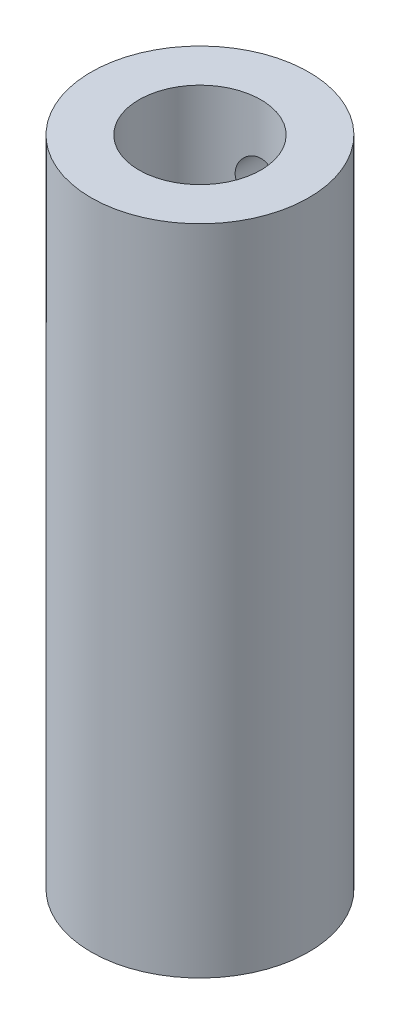
from build123d import *

# Parameters (mm, degrees)
IZIM1_R                     = 7.5
Y_KSEKLIK_EKSTR_ZYON1_DEPTH = 15
IZIM2_R                     = 7.5
IZIM2_R_2                   = 4.2
Y_KSEKLIK_EKSTR_ZYON2_DEPTH = 30
IZIM3_R                     = 1.5
KES_EKSTR_ZYON1_DEPTH       = 10


with BuildPart() as part:
    # Çizim1 → Yükseklik-Ekstrüzyon1 (new body)
    with BuildSketch(Plane(origin=(0, 0, 0), x_dir=(1, 0, 0), z_dir=(0, 1, 0))):
        with Locations(Location((0, 0, 0), (0, 0, 270))):
            Circle(IZIM1_R)
        with BuildLine():
            Line((-1.65, 2.2), (1.65, 2.2))
            ThreePointArc((1.65, 2.2), (0, -2.75), (-1.65, 2.2))
        make_face(mode=Mode.SUBTRACT)
    extrude(amount=Y_KSEKLIK_EKSTR_ZYON1_DEPTH)

    # Çizim2 → Yükseklik-Ekstrüzyon2 (add)
    with BuildSketch(Plane(origin=(0, 15, 0), x_dir=(1, 0, 0), z_dir=(0, 1, 0))):
        with Locations(Location((0, 0, 0), (0, 0, 270))):
            Circle(IZIM2_R)
        with Locations(Location((0, 0, 0), (0, 0, 270))):
            Circle(IZIM2_R_2, mode=Mode.SUBTRACT)
    extrude(amount=Y_KSEKLIK_EKSTR_ZYON2_DEPTH)

    # Çizim3 → Kes-Ekstrüzyon1 (cut)
    with BuildSketch(Plane.XY):
        with Locations(Location((0, 40, 0), (0, 0, 90))):
            Circle(IZIM3_R)
        with Locations(Location((0, 35, 0), (0, 0, 90))):
            Circle(IZIM3_R)
        with Locations(Location((0, 30, 0), (0, 0, 90))):
            Circle(IZIM3_R)
        with Locations((0, 10)):
            Circle(IZIM3_R)
        with Locations((0, 5)):
            Circle(IZIM3_R)
    extrude(amount=-KES_EKSTR_ZYON1_DEPTH, mode=Mode.SUBTRACT)


solid = part.part
